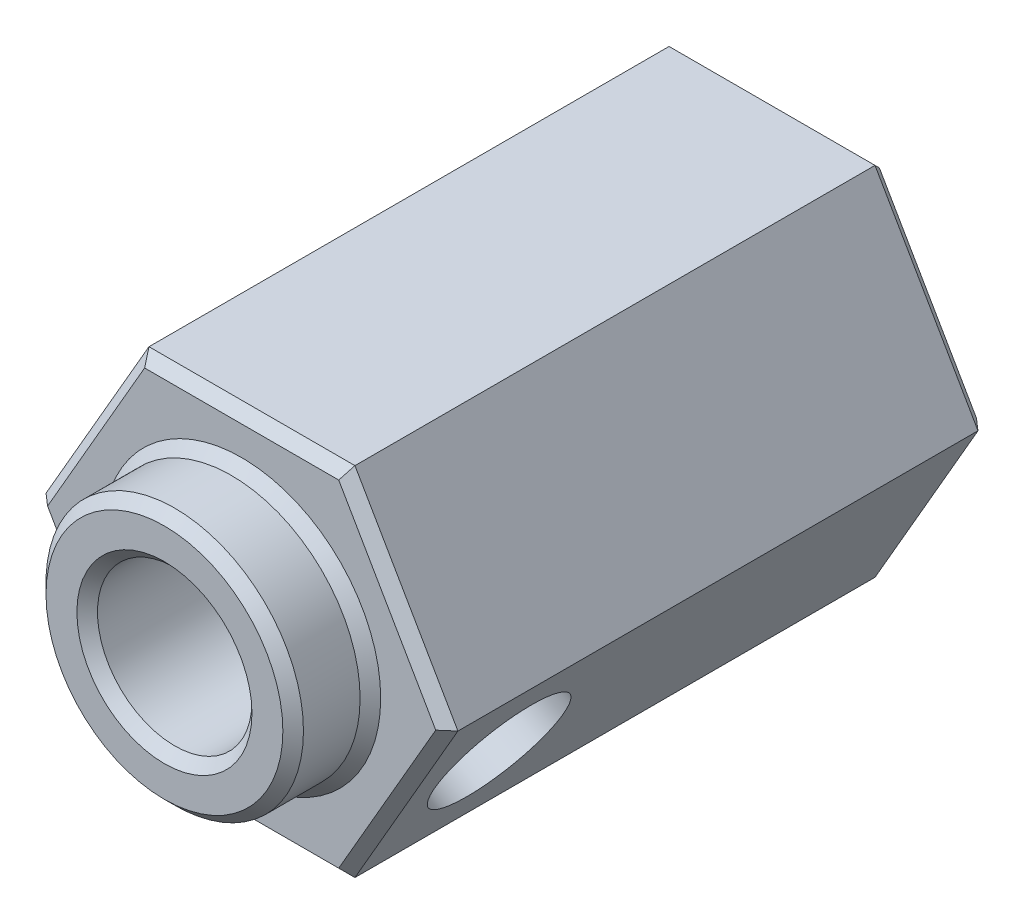
from build123d import *

# Parameters (mm, degrees)
EXTRUDE_1_DEPTH        = 12
SKETCH_2_OUTSIDE_W     = 13.2
SKETCH_2_OUTSIDE_H     = 12.128
SKETCH_2_OUTSIDE_R     = 2.5
CUT_EXTRUDE_1_DEPTH    = 1.5
SKETCH_3_R             = 1.5
CUT_EXTRUDE_2_DEPTH    = 8
HOLE_WIZARD_M3_1_D     = 2.5
HOLE_WIZARD_M3_2_D     = 2.5
HOLE_WIZARD_M3_2_DEPTH = 3.5
HOLE_WIZARD_M3_2_TIP   = 0.751075774
CHAMFER_1_SIZE         = 0.2


with BuildPart() as part:
    # 草图1 → 凸台-拉伸1 (new body)
    with BuildSketch(Plane.XY):
        Polygon((-4, 0), (-2, -3.464101615), (2, -3.464101615), (4, 0), (2, 3.464101615), (-2, 3.464101615), align=None)
    extrude(amount=EXTRUDE_1_DEPTH)

    # 草图2 outside → 切除-拉伸1 (cut)
    with BuildSketch(Plane.XY.offset(12)):
        Rectangle(SKETCH_2_OUTSIDE_W, SKETCH_2_OUTSIDE_H)
        Circle(SKETCH_2_OUTSIDE_R, mode=Mode.SUBTRACT)
    extrude(amount=-CUT_EXTRUDE_1_DEPTH, mode=Mode.SUBTRACT)

    # 草图3 → 切除-拉伸2 (cut)
    with BuildSketch(Plane.XY.offset(12)):
        Circle(SKETCH_3_R)
    extrude(amount=-CUT_EXTRUDE_2_DEPTH, mode=Mode.SUBTRACT)

    # M3 螺纹孔1 (through all)
    with Locations(Plane.XY.offset(4)):
        with Locations((0, 0)):
            Hole(HOLE_WIZARD_M3_1_D / 2)

    # M3 螺纹孔2
    with Locations(Plane(origin=(3, -1.732050808, 8.5), x_dir=(0.5, 0.866025403784, 0), z_dir=(0.866025403784, -0.5, 0))):
        with Locations((0, 0)):
            Hole(HOLE_WIZARD_M3_2_D / 2, depth=HOLE_WIZARD_M3_2_DEPTH)
            with Locations((0, 0, -(HOLE_WIZARD_M3_2_DEPTH + HOLE_WIZARD_M3_2_TIP / 2))):  # 118° drill point
                Cone(0, HOLE_WIZARD_M3_2_D / 2, HOLE_WIZARD_M3_2_TIP, mode=Mode.SUBTRACT)

    # 倒角1
    chamfer_1_edges = [part.edges().sort_by_distance(p)[0] for p in [
        (0, 3.464101615, 10.5),
        (-2.5, 0, 10.5),
        (-3, 1.732050808, 10.5),
        (-3, -1.732050808, 10.5),
        (0, -3.464101615, 10.5),
        (3, -1.732050808, 10.5),
        (3, 1.732050808, 10.5),
        (-2.5, 0, 12),
        (-1.5, 0, 12),
        (1.25, 0, 0),
        (0, 3.464101615, 0),
        (3, 1.732050808, 0),
        (3, -1.732050808, 0),
        (0, -3.464101615, 0),
        (-3, -1.732050808, 0),
        (-3, 1.732050808, 0),
    ]]
    chamfer(chamfer_1_edges, length=CHAMFER_1_SIZE)


solid = part.part
